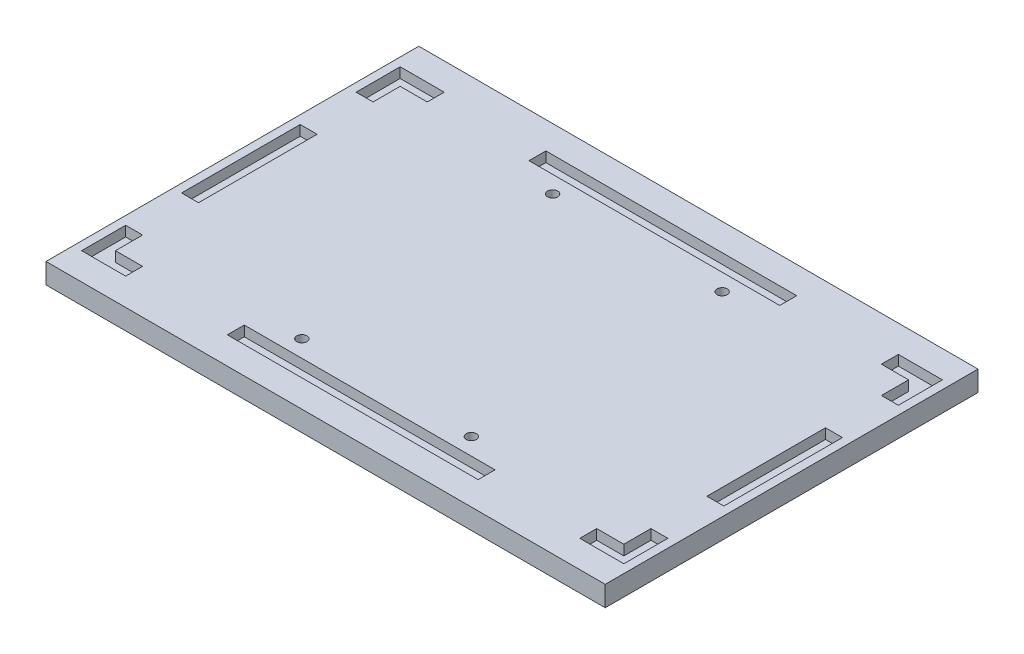
from build123d import *

# Parameters (mm, degrees)
SKETCH1_W           = 165
SKETCH1_H           = 110
BOSS_EXTRUDE1_DEPTH = 6
SKETCH2_W           = 5
SKETCH2_H           = 35
SKETCH2_W_2         = 74
SKETCH2_H_2         = 5
CUT_EXTRUDE1_DEPTH  = 3
SKETCH4_R           = 1.5
CUT_EXTRUDE2_DEPTH  = 111.956279878


with BuildPart() as part:
    # Sketch1 → Boss-Extrude1 (new body)
    with BuildSketch(Plane(origin=(0, 0, 0), x_dir=(1, 0, 0), z_dir=(0, 1, 0))):
        with Locations((-12.658730159, 1.746031746)):
            Rectangle(SKETCH1_W, SKETCH1_H)
    extrude(amount=BOSS_EXTRUDE1_DEPTH)

    # Sketch2 → Cut-Extrude1 (cut)
    with BuildSketch(Plane(origin=(0, 6, 0), x_dir=(1, 0, 0), z_dir=(0, 1, 0))):
        Polygon((-92.658730159, 48.746031746), (-92.658730159, 35.746031746), (-87.658730159, 35.746031746), (-87.658730159, 43.746031746), (-79.658730159, 43.746031746), (-79.658730159, 48.746031746), align=None)
        Polygon((-79.658730159, -40.253968254), (-79.658730159, -45.253968254), (-92.658730159, -45.253968254), (-92.658730159, -32.253968254), (-87.658730159, -32.253968254), (-87.658730159, -40.253968254), align=None)
        Polygon((54.341269841, 43.746031746), (54.341269841, 48.746031746), (67.341269841, 48.746031746), (67.341269841, 35.746031746), (62.341269841, 35.746031746), (62.341269841, 43.746031746), align=None)
        Polygon((62.341269841, -40.253968254), (54.341269841, -40.253968254), (54.341269841, -45.253968254), (67.341269841, -45.253968254), (67.341269841, -32.253968254), (62.341269841, -32.253968254), align=None)
        with Locations((64.841269841, 1.746031746)):
            Rectangle(SKETCH2_W, SKETCH2_H)
        with Locations((-90.158730159, 1.746031746)):
            Rectangle(SKETCH2_W, SKETCH2_H)
        with Locations((-12.658730159, -42.753968254)):
            Rectangle(SKETCH2_W_2, SKETCH2_H_2)
        with Locations((-12.658730159, 46.246031746)):
            Rectangle(SKETCH2_W_2, SKETCH2_H_2)
    extrude(amount=-CUT_EXTRUDE1_DEPTH, mode=Mode.SUBTRACT)

    # Sketch4 → Cut-Extrude2 (cut, through all)
    with BuildSketch(Plane(origin=(0, 6, 0), x_dir=(1, 0, 0), z_dir=(0, 1, 0))):
        with Locations(Location((-37.658730159, 38.746031746, 0), (0, 0, 270))):
            Circle(SKETCH4_R)
        with Locations(Location((12.341269841, 38.746031746, 0), (0, 0, 90))):
            Circle(SKETCH4_R)
        with Locations(Location((12.341269841, -35.253968254, 0), (0, 0, 270))):
            Circle(SKETCH4_R)
        with Locations(Location((-37.658730159, -35.253968254, 0), (0, 0, 90))):
            Circle(SKETCH4_R)
    extrude(amount=-CUT_EXTRUDE2_DEPTH, mode=Mode.SUBTRACT)


solid = part.part
